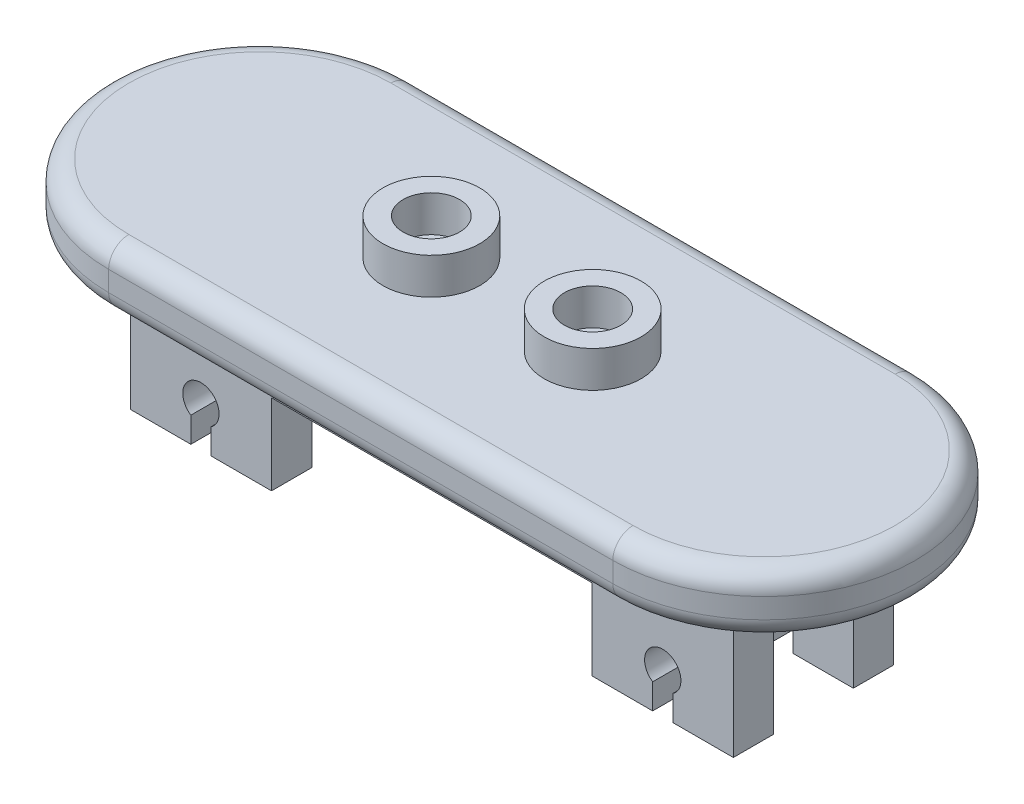
from build123d import *

# Parameters (mm, degrees)
BOSS_EXTRUDE1_DEPTH = 3
FILLET1_R           = 1
SKETCH20_W          = 15.9
SKETCH20_H          = 7.95
BOSS_EXTRUDE2_DEPTH = 3
SHELL1_T            = -1.2
SKETCH21_W          = 7
SKETCH21_H          = 2
BOSS_EXTRUDE4_DEPTH = 7
CUT_EXTRUDE1_DEPTH  = 25.097211976
SKETCH23_R          = 2.4
SKETCH23_R_2        = 1.4
BOSS_EXTRUDE5_DEPTH = 1.8


with BuildPart() as part:
    # Sketch1 → Boss-Extrude1 (new body)
    with BuildSketch(Plane(origin=(0, 0, 0), x_dir=(1, 0, 0), z_dir=(0, 1, 0))):
        with BuildLine():
            Line((-12.5, -7.5), (12.5, -7.5))
            ThreePointArc((12.5, -7.5), (20, 0), (12.5, 7.5))
            Line((12.5, 7.5), (-12.5, 7.5))
            ThreePointArc((-12.5, 7.5), (-20, 0), (-12.5, -7.5))
        make_face()
    extrude(amount=BOSS_EXTRUDE1_DEPTH)

    # Fillet1
    fillet1_edges = [part.edges().sort_by_distance(p)[0] for p in [
        (-20, 3, 0),
        (0, 3, 7.5),
        (20, 3, 0),
        (0, 0, 7.5),
        (-20, 0, 0),
        (0, 0, -7.5),
        (20, 0, 0),
        (0, 3, -7.5),
    ]]
    fillet(fillet1_edges, radius=FILLET1_R)

    # Sketch20 → Boss-Extrude2 (add)
    with BuildSketch(Plane.XZ):
        Rectangle(SKETCH20_W, SKETCH20_H)
    extrude(amount=BOSS_EXTRUDE2_DEPTH)

    # Shell1
    shell1_openings = [part.faces().sort_by_distance(p)[0] for p in [
        (0, -3, 0),
    ]]
    offset(amount=SHELL1_T, openings=shell1_openings, kind=Kind.INTERSECTION)

    # Sketch21 → Boss-Extrude4 (add)
    with BuildSketch(Plane.XZ):
        with Locations((11.45, -2.975)):
            Rectangle(SKETCH21_W, SKETCH21_H)
        with Locations((11.45, 2.975)):
            Rectangle(SKETCH21_W, SKETCH21_H)
    boss_extrude4 = extrude(amount=BOSS_EXTRUDE4_DEPTH)

    # Sketch22 → Cut-Extrude1 (cut, through all)
    with BuildSketch(Plane.XY.offset(3.975)):
        with BuildLine():
            Line((11.95, -7), (10.95, -7))
            Line((10.95, -7), (10.95, -5.748331477))
            ThreePointArc((10.95, -5.748331477), (11.45, -4.1), (11.95, -5.748331477))
            Line((11.95, -5.748331477), (11.95, -7))
        make_face()
    cut_extrude1 = extrude(amount=-CUT_EXTRUDE1_DEPTH, mode=Mode.SUBTRACT)

    # Mirror1: Boss-Extrude4, Cut-Extrude1 across plane
    add(boss_extrude4.mirror(Plane(origin=(0, 0, 0), x_dir=(0, 0, 1), z_dir=(1, 0, 0))))
    add(cut_extrude1.mirror(Plane(origin=(0, 0, 0), x_dir=(0, 0, 1), z_dir=(1, 0, 0))), mode=Mode.SUBTRACT)

    # Sketch23 → Boss-Extrude5 (add)
    with BuildSketch(Plane(origin=(0, 3, 0), x_dir=(1, 0, 0), z_dir=(0, 1, 0))):
        with Locations(Location((-4, 0, 0), (0, 0, 270))):
            Circle(SKETCH23_R)
        with Locations(Location((-4, 0, 0), (0, 0, 270))):
            Circle(SKETCH23_R_2, mode=Mode.SUBTRACT)
    boss_extrude5 = extrude(amount=BOSS_EXTRUDE5_DEPTH)

    # Mirror2: Boss-Extrude5 across plane
    add(boss_extrude5.mirror(Plane(origin=(0, 0, 0), x_dir=(0, 0, 1), z_dir=(1, 0, 0))))


solid = part.part
